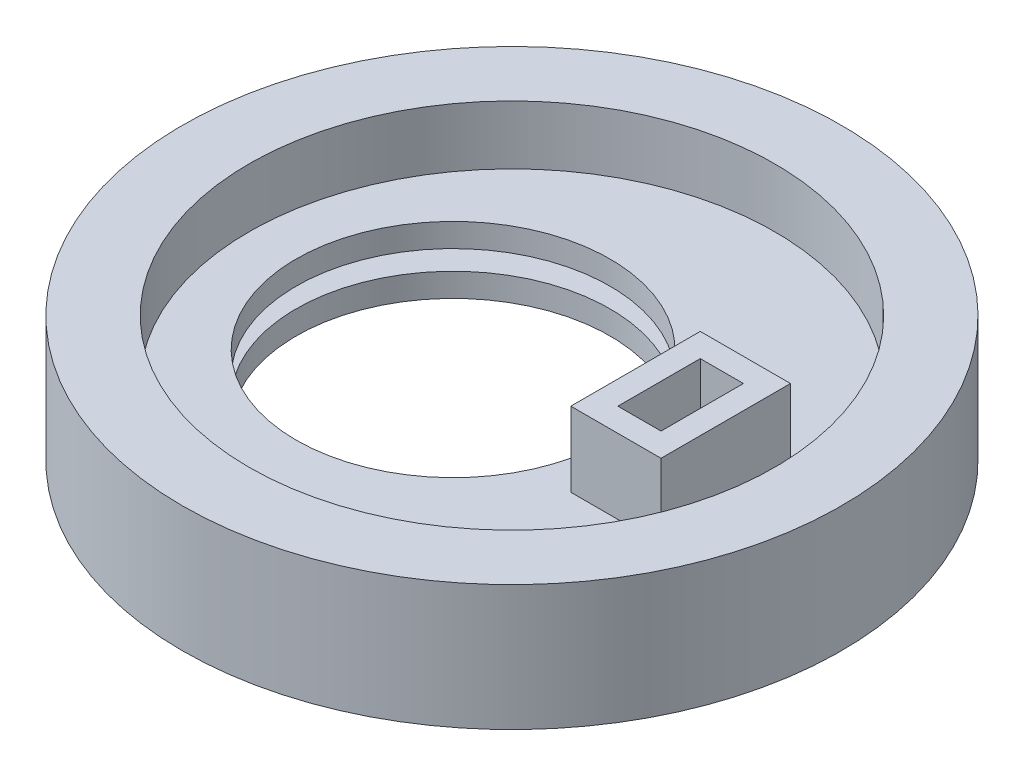
from build123d import *

# Parameters (mm, degrees)
SKETCH1_R           = 14.6
BOSS_EXTRUDE1_DEPTH = 3
SHELL2_T            = 1
SKETCH2_W           = 2.2
SKETCH2_H           = 4.2
BOSS_EXTRUDE2_DEPTH = 5
SHELL3_T            = 1.2
SKETCH3_R           = 8
CUT_EXTRUDE1_DEPTH  = 25.06075643


with BuildPart() as part:
    # Sketch1 → Boss-Extrude1 (new body)
    with BuildSketch(Plane(origin=(0, 0, 0), x_dir=(1, 0, 0), z_dir=(0, 1, 0))):
        with Locations(Location((0, 0, 0), (0, 0, 270))):
            Circle(SKETCH1_R)
    extrude(amount=BOSS_EXTRUDE1_DEPTH)

    # Shell2
    shell2_openings = [part.faces().sort_by_distance(p)[0] for p in [
        (0, 3, 0),
    ]]
    offset(amount=SHELL2_T, openings=shell2_openings, kind=Kind.INTERSECTION)

    # Sketch2 → Boss-Extrude2 (add)
    with BuildSketch(Plane(origin=(0, 0, 0), x_dir=(1, 0, 0), z_dir=(0, 1, 0))):
        with Locations((8.6, 0)):
            Rectangle(SKETCH2_W, SKETCH2_H)
    extrude(amount=BOSS_EXTRUDE2_DEPTH)

    # Shell3
    shell3_openings = [part.faces().sort_by_distance(p)[0] for p in [
        (8.6, 5, 0),
    ]]
    offset(amount=SHELL3_T, openings=shell3_openings, kind=Kind.INTERSECTION)

    # Sketch3 → Cut-Extrude1 (cut, through all)
    with BuildSketch(Plane(origin=(0, 1.2, 0), x_dir=(1, 0, 0), z_dir=(0, 1, 0))):
        with Locations(Location((-3, 0, 0), (0, 0, 270))):
            Circle(SKETCH3_R)
    extrude(amount=-CUT_EXTRUDE1_DEPTH, mode=Mode.SUBTRACT)


solid = part.part
